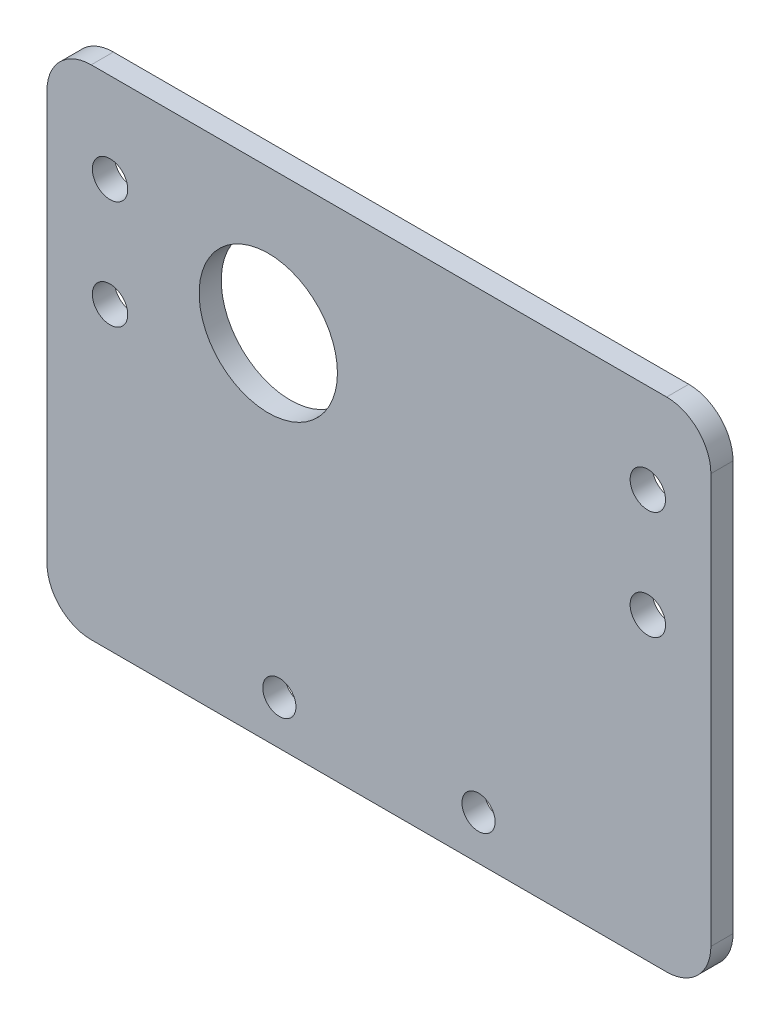
from build123d import *

# Parameters (mm, degrees)
SKETCH_1_W          = 60
SKETCH_1_H          = 45
EXTRUDE_1_DEPTH     = 2
FILLET_1_R          = 4
SKETCH_2_R          = 1.5
CUT_EXTRUDE_1_DEPTH = 2
SKETCH_3_R          = 1.6
CUT_EXTRUDE_2_DEPTH = 2
SKETCH_4_R          = 6.25
CUT_EXTRUDE_3_DEPTH = 2


with BuildPart() as part:
    # 草图1 → 凸台-拉伸1 (new body)
    with BuildSketch(Plane.XY):
        with Locations((30, 22.5)):
            Rectangle(SKETCH_1_W, SKETCH_1_H)
    extrude(amount=EXTRUDE_1_DEPTH)

    # 圆角1
    fillet_1_edges = [part.edges().sort_by_distance(p)[0] for p in [
        (0, 45, 1),
        (60, 45, 1),
        (60, 0, 1),
        (0, 0, 1),
    ]]
    fillet(fillet_1_edges, radius=FILLET_1_R)

    # 草图2 → 切除-拉伸1 (cut)
    with BuildSketch(Plane(origin=(0, 0, 0), x_dir=(-1, 0, 0), z_dir=(0, 0, -1))):
        with Locations((-39, 4)):
            Circle(SKETCH_2_R)
        with Locations((-21, 4)):
            Circle(SKETCH_2_R)
    extrude(amount=-CUT_EXTRUDE_1_DEPTH, mode=Mode.SUBTRACT)

    # 草图3 → 切除-拉伸2 (cut)
    with BuildSketch(Plane.XY.offset(2)):
        with Locations((5.7, 36.9)):
            Circle(SKETCH_3_R)
        with Locations((5.7, 27.1)):
            Circle(SKETCH_3_R)
        with Locations((54.3, 36.9)):
            Circle(SKETCH_3_R)
        with Locations((54.3, 27.1)):
            Circle(SKETCH_3_R)
    extrude(amount=-CUT_EXTRUDE_2_DEPTH, mode=Mode.SUBTRACT)

    # 草图4 → 切除-拉伸3 (cut)
    with BuildSketch(Plane.XY.offset(2)):
        with Locations((20, 32)):
            Circle(SKETCH_4_R)
    extrude(amount=-CUT_EXTRUDE_3_DEPTH, mode=Mode.SUBTRACT)


solid = part.part
